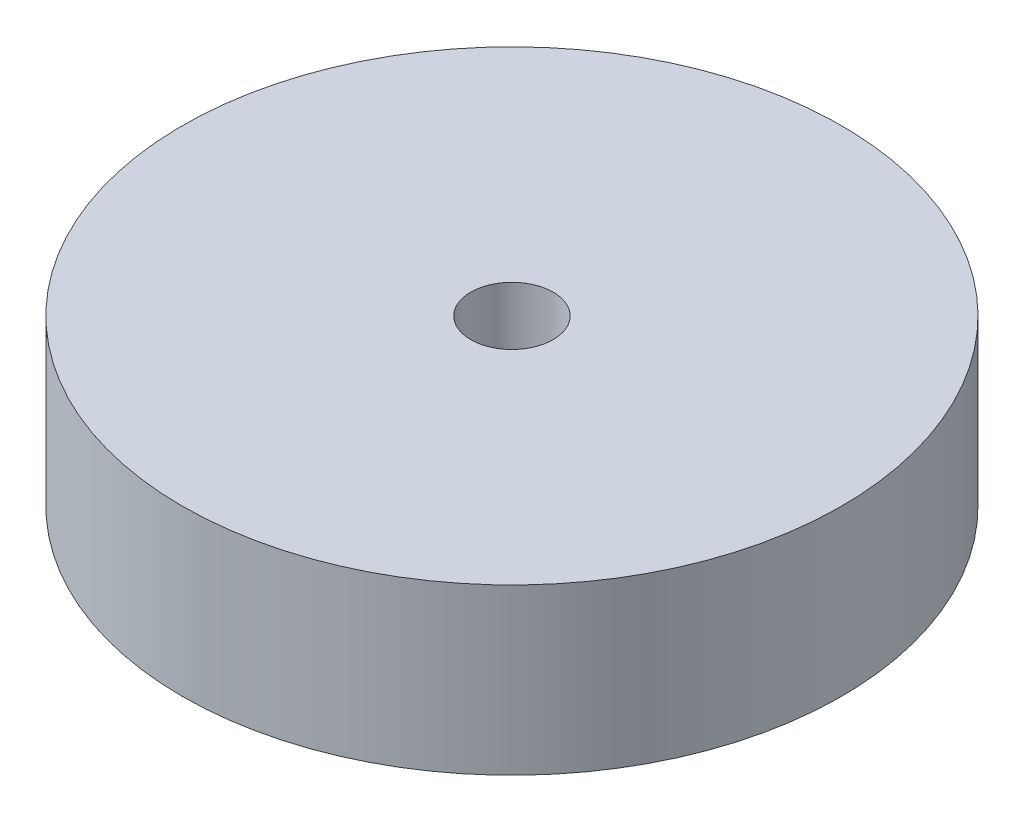
from build123d import *

# Parameters (mm, degrees)
SKETCH1_R           = 3.175
SKETCH1_R_2         = 0.396875
BOSS_EXTRUDE1_DEPTH = 1.5875


with BuildPart() as part:
    # Sketch1 → Boss-Extrude1 (new body)
    with BuildSketch(Plane(origin=(0, 0, 0), x_dir=(1, 0, 0), z_dir=(0, 1, 0))):
        with Locations(Location((0, 0, 0), (0, 0, 270))):
            Circle(SKETCH1_R)
        with Locations(Location((0, 0, 0), (0, 0, 270))):
            Circle(SKETCH1_R_2, mode=Mode.SUBTRACT)
    extrude(amount=BOSS_EXTRUDE1_DEPTH)


solid = part.part
